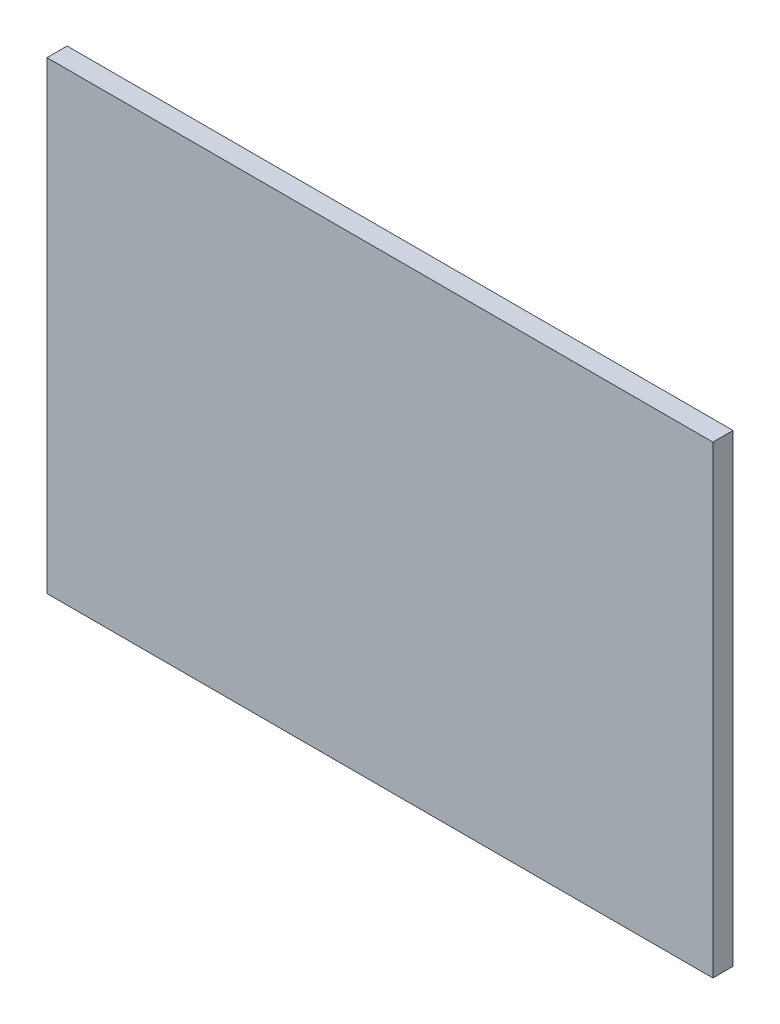
from build123d import *

# Parameters (mm, degrees)
CROQUIS1_W              = 660
CROQUIS1_H              = 460
SALIENTE_EXTRUIR1_DEPTH = 20


with BuildPart() as part:
    # Croquis1 → Saliente-Extruir1 (new body)
    with BuildSketch(Plane.XY):
        Rectangle(CROQUIS1_W, CROQUIS1_H)
    extrude(amount=SALIENTE_EXTRUIR1_DEPTH)


solid = part.part
